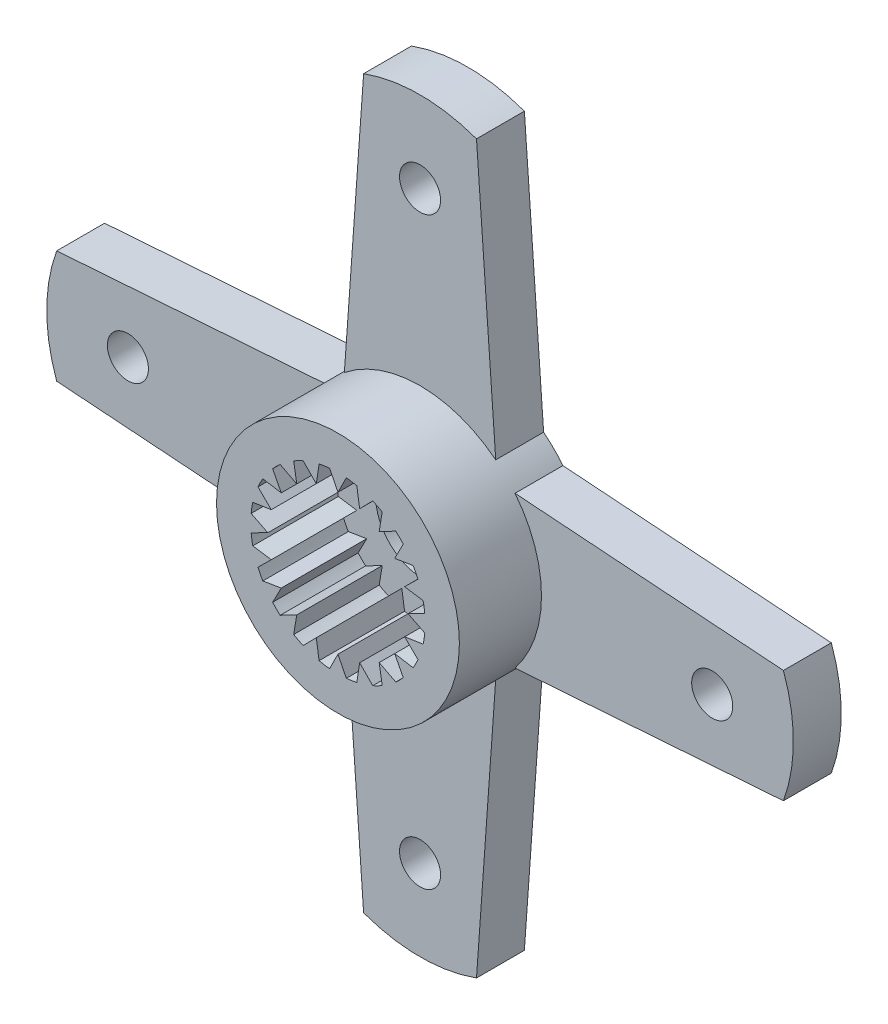
from build123d import *

# Parameters (mm, degrees)
SKETCH2_R           = 3.55
BOSS_EXTRUDE1_DEPTH = 3.8
BOSS_EXTRUDE2_DEPTH = 1.4
SKETCH5_R           = 2.549999919
CUT_EXTRUDE1_DEPTH  = 2.5
BOSS_EXTRUDE3_DEPTH = 2.5
SKETCH6_R           = 1.4
CUT_EXTRUDE2_DEPTH  = 12.745554295
SKETCH7_R           = 0.6
CUT_EXTRUDE3_DEPTH  = 12.724676785
CIRPATTERN1_COUNT   = 4
CIRPATTERN2_COUNT   = 4


with BuildPart() as part:
    # Sketch2 → Boss-Extrude1 (new body)
    with BuildSketch(Plane.XY):
        Circle(SKETCH2_R)
    extrude(amount=-BOSS_EXTRUDE1_DEPTH)

    # Sketch4 → Boss-Extrude2 (add)
    with BuildSketch(Plane.XY.offset(-2.4)):
        with BuildLine():
            Line((2.776387215, 2.212277889), (10.622617722, 1.649999976))
            ThreePointArc((10.622617722, 1.649999976), (10.913548722, 0), (10.622617722, -1.649999976))
            Line((10.622617722, -1.649999976), (2.776387215, -2.212277889))
            ThreePointArc((2.776387215, -2.212277889), (3.549999952, 0), (2.776387215, 2.212277889))
        make_face()
    boss_extrude2 = extrude(amount=-BOSS_EXTRUDE2_DEPTH)

    # Sketch5 → Cut-Extrude1 (cut)
    with BuildSketch(Plane.XY):
        Circle(SKETCH5_R)
    extrude(amount=-CUT_EXTRUDE1_DEPTH, mode=Mode.SUBTRACT)

    # Sketch3 → Boss-Extrude3 (add)
    with BuildSketch(Plane.XY):
        with BuildLine():
            Line((-0.244697916, 2.538232164), (0, 2.049999952))
            Line((0, 2.049999952), (0.244697916, 2.538232164))
            ThreePointArc((0.244697916, 2.538232164), (0, 2.549999919), (-0.244697916, 2.538232164))
        make_face()
        with BuildLine():
            Line((0.551635326, 2.489618054), (0.633484824, 1.949665813))
            Line((0.633484824, 1.949665813), (1.017078422, 2.338386424))
            ThreePointArc((1.017078422, 2.338386424), (0.787993311, 2.42519404), (0.551635326, 2.489618054))
        make_face()
        with BuildLine():
            Line((1.29397066, 2.197302783), (1.204959739, 1.6584848))
            Line((1.204959739, 1.6584848), (1.689900206, 1.90964313))
            ThreePointArc((1.689900206, 1.90964313), (1.498852346, 2.06299327), (1.29397066, 2.197302783))
        make_face()
        with BuildLine():
            Line((1.90964313, 1.689900206), (1.6584848, 1.204959739))
            Line((1.6584848, 1.204959739), (2.197302783, 1.29397066))
            ThreePointArc((2.197302783, 1.29397066), (2.06299327, 1.498852346), (1.90964313, 1.689900206))
        make_face()
        with BuildLine():
            Line((2.338386424, 1.017078422), (1.949665813, 0.633484824))
            Line((1.949665813, 0.633484824), (2.489618054, 0.551635326))
            ThreePointArc((2.489618054, 0.551635326), (2.42519404, 0.787993311), (2.338386424, 1.017078422))
        make_face()
        with BuildLine():
            Line((2.538232164, 0.244697916), (2.049999952, 0))
            Line((2.049999952, 0), (2.538232164, -0.244697916))
            ThreePointArc((2.538232164, -0.244697916), (2.549999919, 0), (2.538232164, 0.244697916))
        make_face()
        with BuildLine():
            Line((2.489618054, -0.551635326), (1.949665813, -0.633484824))
            Line((1.949665813, -0.633484824), (2.338386424, -1.017078422))
            ThreePointArc((2.338386424, -1.017078422), (2.42519404, -0.787993311), (2.489618054, -0.551635326))
        make_face()
        with BuildLine():
            Line((2.197302783, -1.29397066), (1.6584848, -1.204959739))
            Line((1.6584848, -1.204959739), (1.90964313, -1.689900206))
            ThreePointArc((1.90964313, -1.689900206), (2.06299327, -1.498852346), (2.197302783, -1.29397066))
        make_face()
        with BuildLine():
            Line((1.689900206, -1.90964313), (1.204959739, -1.6584848))
            Line((1.204959739, -1.6584848), (1.29397066, -2.197302783))
            ThreePointArc((1.29397066, -2.197302783), (1.498852346, -2.06299327), (1.689900206, -1.90964313))
        make_face()
        with BuildLine():
            Line((1.017078422, -2.338386424), (0.633484824, -1.949665813))
            Line((0.633484824, -1.949665813), (0.551635326, -2.489618054))
            ThreePointArc((0.551635326, -2.489618054), (0.787993311, -2.42519404), (1.017078422, -2.338386424))
        make_face()
        with BuildLine():
            Line((0.244697916, -2.538232164), (0, -2.049999952))
            Line((0, -2.049999952), (-0.244697916, -2.538232164))
            ThreePointArc((-0.244697916, -2.538232164), (0, -2.549999919), (0.244697916, -2.538232164))
        make_face()
        with BuildLine():
            Line((-0.551635326, -2.489618054), (-0.633484824, -1.949665813))
            Line((-0.633484824, -1.949665813), (-1.017078422, -2.338386424))
            ThreePointArc((-1.017078422, -2.338386424), (-0.787993311, -2.42519404), (-0.551635326, -2.489618054))
        make_face()
        with BuildLine():
            Line((-1.29397066, -2.197302783), (-1.204959739, -1.6584848))
            Line((-1.204959739, -1.6584848), (-1.689900206, -1.90964313))
            ThreePointArc((-1.689900206, -1.90964313), (-1.498852346, -2.06299327), (-1.29397066, -2.197302783))
        make_face()
        with BuildLine():
            Line((-1.90964313, -1.689900206), (-1.6584848, -1.204959739))
            Line((-1.6584848, -1.204959739), (-2.197302783, -1.29397066))
            ThreePointArc((-2.197302783, -1.29397066), (-2.06299327, -1.498852346), (-1.90964313, -1.689900206))
        make_face()
        with BuildLine():
            Line((-2.338386424, -1.017078422), (-1.949665813, -0.633484824))
            Line((-1.949665813, -0.633484824), (-2.489618054, -0.551635326))
            ThreePointArc((-2.489618054, -0.551635326), (-2.42519404, -0.787993311), (-2.338386424, -1.017078422))
        make_face()
        with BuildLine():
            Line((-2.538232164, -0.244697916), (-2.049999952, 0))
            Line((-2.049999952, 0), (-2.538232164, 0.244697916))
            ThreePointArc((-2.538232164, 0.244697916), (-2.549999919, 0), (-2.538232164, -0.244697916))
        make_face()
        with BuildLine():
            Line((-2.489618054, 0.551635326), (-1.949665813, 0.633484824))
            Line((-1.949665813, 0.633484824), (-2.338386424, 1.017078422))
            ThreePointArc((-2.338386424, 1.017078422), (-2.42519404, 0.787993311), (-2.489618054, 0.551635326))
        make_face()
        with BuildLine():
            Line((-2.197302783, 1.29397066), (-1.6584848, 1.204959739))
            Line((-1.6584848, 1.204959739), (-1.90964313, 1.689900206))
            ThreePointArc((-1.90964313, 1.689900206), (-2.06299327, 1.498852346), (-2.197302783, 1.29397066))
        make_face()
        with BuildLine():
            Line((-1.689900206, 1.90964313), (-1.204959739, 1.6584848))
            Line((-1.204959739, 1.6584848), (-1.29397066, 2.197302783))
            ThreePointArc((-1.29397066, 2.197302783), (-1.498852346, 2.06299327), (-1.689900206, 1.90964313))
        make_face()
        with BuildLine():
            Line((-1.017078422, 2.338386424), (-0.633484824, 1.949665813))
            Line((-0.633484824, 1.949665813), (-0.551635326, 2.489618054))
            ThreePointArc((-0.551635326, 2.489618054), (-0.787993311, 2.42519404), (-1.017078422, 2.338386424))
        make_face()
    extrude(amount=-BOSS_EXTRUDE3_DEPTH)

    # Sketch6 → Cut-Extrude2 (cut, through all)
    with BuildSketch(Plane.XY.offset(-2.5)):
        Circle(SKETCH6_R)
    extrude(amount=-CUT_EXTRUDE2_DEPTH, mode=Mode.SUBTRACT)

    # Sketch7 → Cut-Extrude3 (cut, through all)
    with BuildSketch(Plane.XY.offset(-2.4)):
        with Locations((8.5405208, 0)):
            Circle(SKETCH7_R)
    cut_extrude3 = extrude(amount=-CUT_EXTRUDE3_DEPTH, mode=Mode.SUBTRACT)

    # CirPattern1: Boss-Extrude2 ×4 about axis
    cirpattern1_axis = Axis((0, 0, 0), (0, 0, 1))
    for i in range(1, CIRPATTERN1_COUNT):
        add(boss_extrude2.rotate(cirpattern1_axis, i * 360 / CIRPATTERN1_COUNT))

    # CirPattern2: Cut-Extrude3 ×4 about axis
    cirpattern2_axis = Axis((0, 0, 0), (0, 0, 1))
    for i in range(1, CIRPATTERN2_COUNT):
        add(cut_extrude3.rotate(cirpattern2_axis, i * 360 / CIRPATTERN2_COUNT), mode=Mode.SUBTRACT)


solid = part.part
